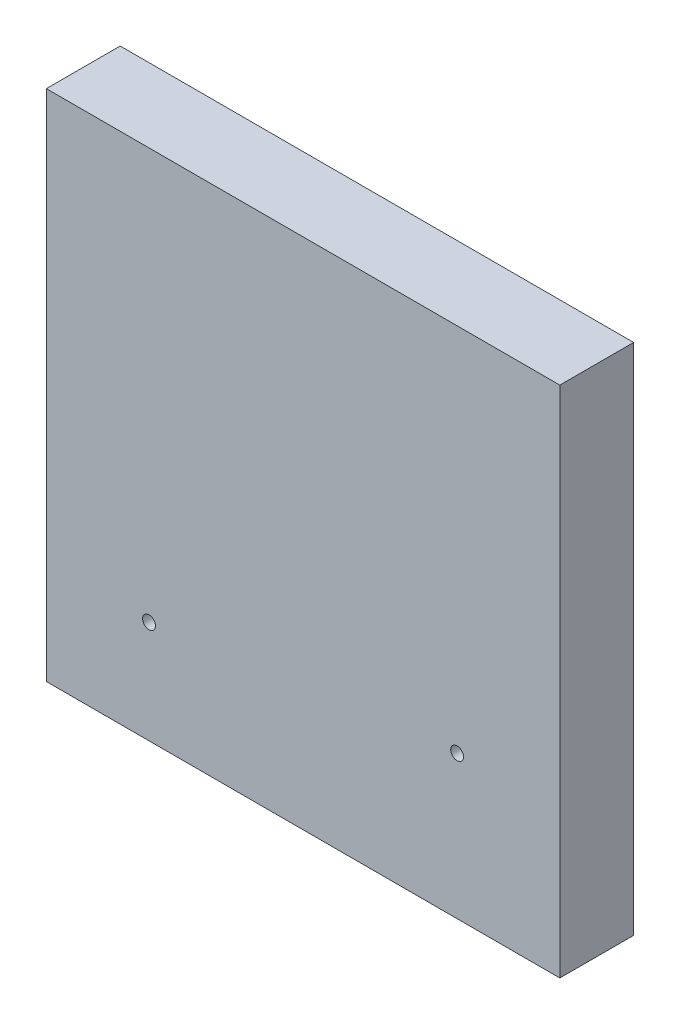
from build123d import *

# Parameters (mm, degrees)
SKETCH1_W           = 127
SKETCH1_H           = 127
SKETCH1_R           = 1.5875
BOSS_EXTRUDE1_DEPTH = 18.2626


with BuildPart() as part:
    # Sketch1 → Boss-Extrude1 (new body)
    with BuildSketch(Plane.XY):
        with Locations((63.5, 63.5)):
            Rectangle(SKETCH1_W, SKETCH1_H)
        with Locations((25.4, 25.4)):
            Circle(SKETCH1_R, mode=Mode.SUBTRACT)
        with Locations((101.6, 35.433)):
            Circle(SKETCH1_R, mode=Mode.SUBTRACT)
    extrude(amount=BOSS_EXTRUDE1_DEPTH)


solid = part.part
